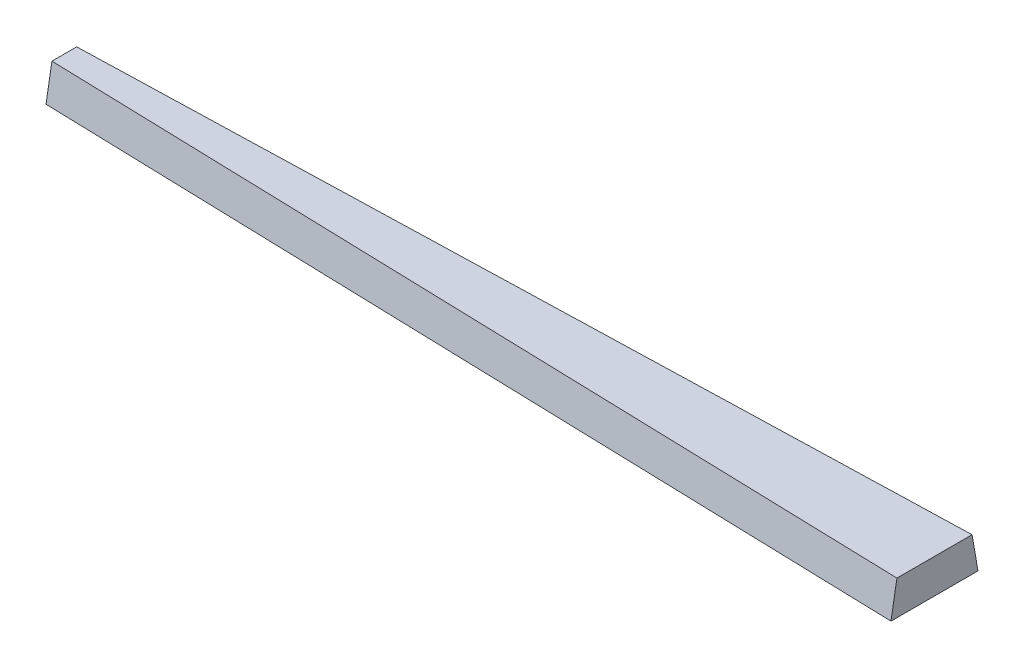
from build123d import *

# Parameters (mm, degrees)
SKETCH1_W           = 482.6
SKETCH1_H           = 50.8
BOSS_EXTRUDE1_DEPTH = 19.05
SKETCH5_W           = 508
SKETCH5_H           = 50.8
CUT_EXTRUDE1_DEPTH  = 246.940876462


with BuildPart() as part:
    # Sketch1 → Boss-Extrude1 (new body)
    with BuildSketch(Plane(origin=(0, 0, 0), x_dir=(1, 0, 0), z_dir=(0, 1, 0))):
        Rectangle(SKETCH1_W, SKETCH1_H)
    extrude(amount=BOSS_EXTRUDE1_DEPTH)

    # Sketch5 → Cut-Extrude1 (cut, through all)
    with BuildSketch(Plane(origin=(-0.481532302, 2.873320636, 16.634752254), x_dir=(0.9995934063300581, 0.0049512943147540294, 0.028080361573174478), z_dir=(-0.028513367553161754, 0.17014029390333138, 0.9850072427455884))):
        with Locations((0, 9.697527332)):
            Rectangle(SKETCH5_W, SKETCH5_H)
    cut_extrude1 = extrude(amount=CUT_EXTRUDE1_DEPTH, mode=Mode.SUBTRACT)

    # Mirror1: Cut-Extrude1 across plane
    add(cut_extrude1.mirror(Plane.XY), mode=Mode.SUBTRACT)


solid = part.part
